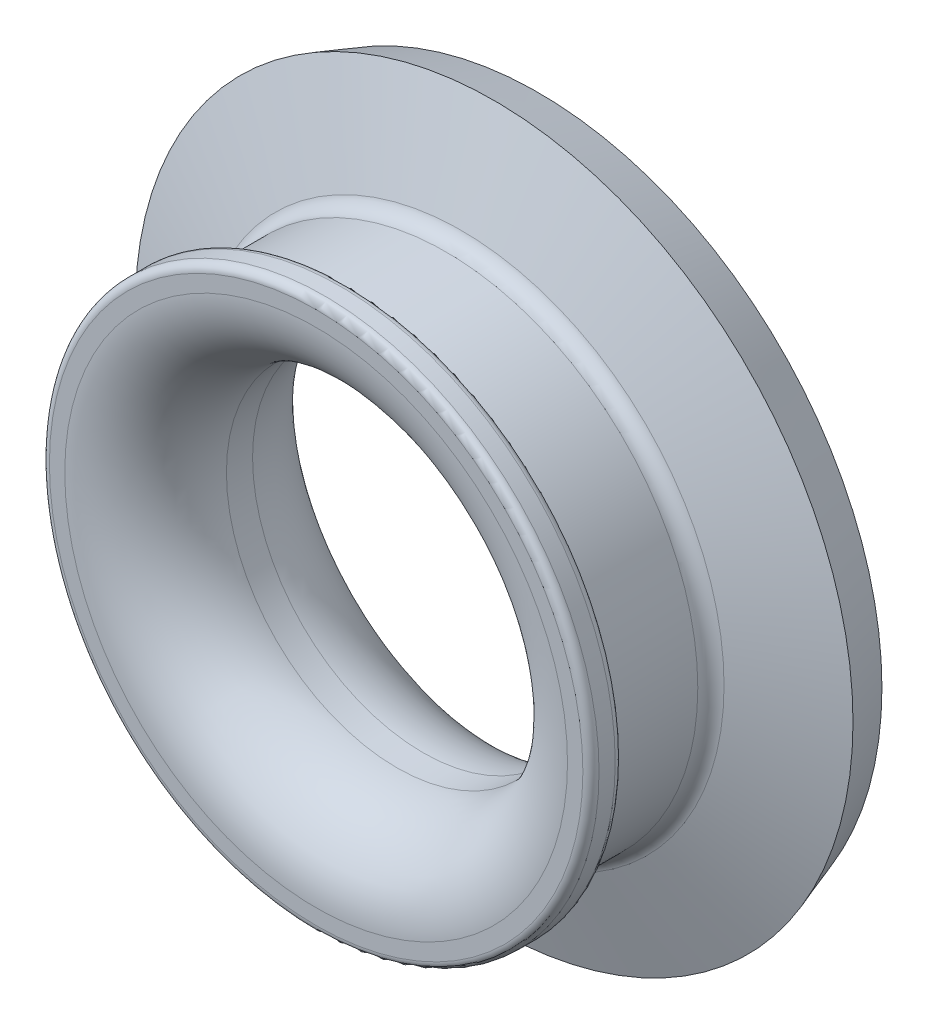
from build123d import *


with BuildPart() as part:
    # Sketch1 → Revolve1 (revolve)
    with BuildSketch(Plane(origin=(0, 0, 0), x_dir=(0, 0, -1), z_dir=(1, 0, 0)), mode=Mode.PRIVATE) as revolve1_sk:
        with BuildLine():
            Line((0, 33), (0, 31.1))
            ThreePointArc((0, 31.1), (2.928932188, 24.028932188), (10, 21.1))
            Line((10, 21.1), (13.233881182, 21.1))
            ThreePointArc((13.233881182, 21.1), (20.785725875, 23.774248463), (24.971652391, 30.60505971))
            Line((24.971652391, 30.60505971), (27.5, 42.5))
            Line((27.5, 42.5), (22.020036496, 44.4))
            Line((22.020036496, 44.4), (17.961988444, 32.504269348))
            ThreePointArc((17.961988444, 32.504269348), (17.232829398, 31.523429789), (16.069098609, 31.15))
            Line((16.069098609, 31.15), (5, 31.15))
            ThreePointArc((5, 31.15), (4.292893219, 31.442893219), (4, 32.15))
            Line((4, 32.15), (4, 33))
            ThreePointArc((4, 33), (3.707106781, 33.707106781), (3, 34))
            Line((3, 34), (1, 34))
            ThreePointArc((1, 34), (0.292893219, 33.707106781), (0, 33))
        make_face()
    revolve(revolve1_sk.sketch.rotate(Axis((0, 0, 0), (0, 0, -1)), 90), axis=Axis((0, 0, 0), (0, 0, -1)))


solid = part.part
